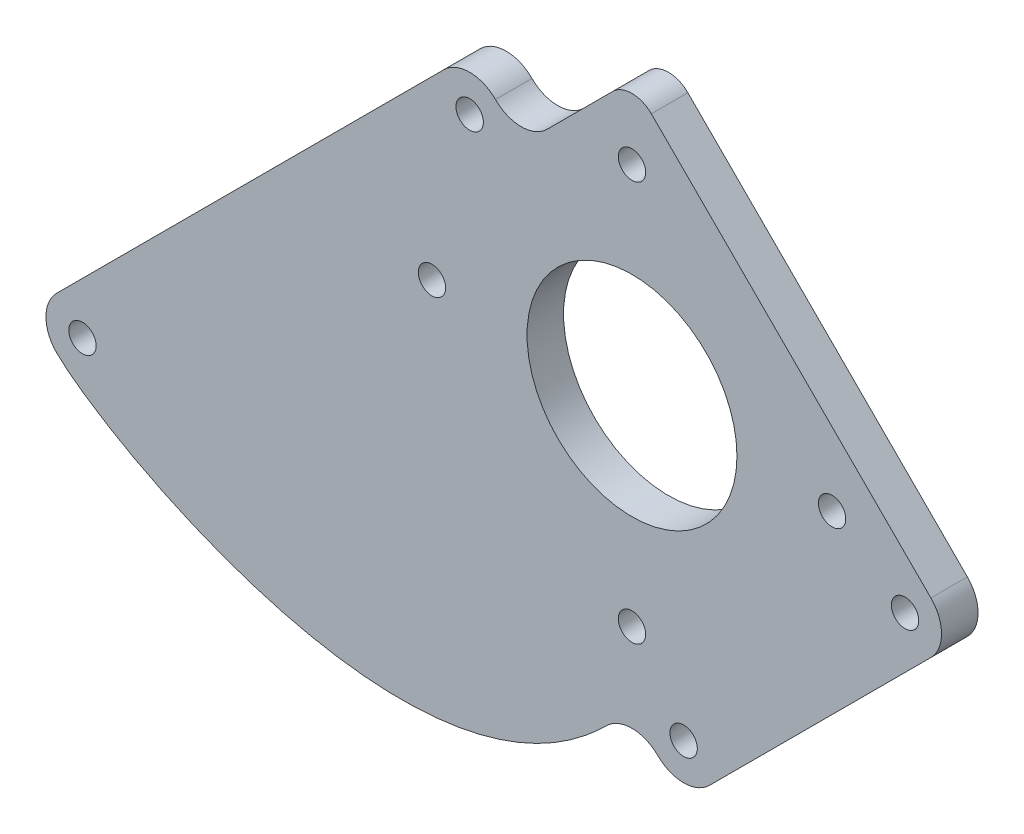
from build123d import *

# Parameters (mm, degrees)
SKETCH1_R           = 1.5
SKETCH1_R_2         = 11.5
BOSS_EXTRUDE1_DEPTH = 4
FILLET1_R           = 3


with BuildPart() as part:
    # Sketch1 → Boss-Extrude1 (new body)
    with BuildSketch(Plane.XY):
        with BuildLine():
            Line((-20.616075737, 20.616075737), (-63.042482608, -21.810331134))
            ThreePointArc((-63.042482608, -21.810331134), (-64.214055483, -24.638758259), (-63.042482608, -27.467185384))
            add(Edge.make_bspline(
                [(-2.828427125, -32.7468701), (-22.744659396, -52.590484488), (-57.268164388, -33.201805253), (-63.042482608, -27.467185384)],
                knots=[0, 0, 0, 0, 1, 1, 1, 1], degree=3))
            ThreePointArc((-2.828427125, -32.7468701), (0, -31.575297224), (2.828427125, -32.7468701))
            ThreePointArc((2.828427125, -32.7468701), (5.656854249, -33.918442975), (8.485281374, -32.7468701))
            Line((8.485281374, -32.7468701), (32.7468701, -8.485281374))
            ThreePointArc((32.7468701, -8.485281374), (33.918442975, -5.656854249), (32.7468701, -2.828427125))
            Line((32.7468701, -2.828427125), (0, 29.918442975))
            Line((0, 29.918442975), (-9.302367238, 20.616075737))
            ThreePointArc((-9.302367238, 20.616075737), (-12.130794363, 19.444502862), (-14.959221487, 20.616075737))
            ThreePointArc((-14.959221487, 20.616075737), (-17.787648612, 21.787648612), (-20.616075737, 20.616075737))
        make_face()
        with Locations((29.918442975, -5.656854249)):
            Circle(SKETCH1_R, mode=Mode.SUBTRACT)
        with Locations((-21.920310217, 0)):
            Circle(SKETCH1_R, mode=Mode.SUBTRACT)
        with Locations((0, 21.920310217)):
            Circle(SKETCH1_R, mode=Mode.SUBTRACT)
        with Locations((21.920310217, 0)):
            Circle(SKETCH1_R, mode=Mode.SUBTRACT)
        Circle(SKETCH1_R_2, mode=Mode.SUBTRACT)
        with Locations((0, -21.920310217)):
            Circle(SKETCH1_R, mode=Mode.SUBTRACT)
        with Locations((5.656854249, -29.918442975)):
            Circle(SKETCH1_R, mode=Mode.SUBTRACT)
        with Locations((-17.787648612, 17.787648612)):
            Circle(SKETCH1_R, mode=Mode.SUBTRACT)
        with Locations((-60.214055483, -24.638758259)):
            Circle(SKETCH1_R, mode=Mode.SUBTRACT)
    extrude(amount=BOSS_EXTRUDE1_DEPTH)

    # Fillet1
    fillet1_edges = [part.edges().sort_by_distance(p)[0] for p in [
        (0, 29.918442975, 2),
    ]]
    fillet(fillet1_edges, radius=FILLET1_R)


solid = part.part
